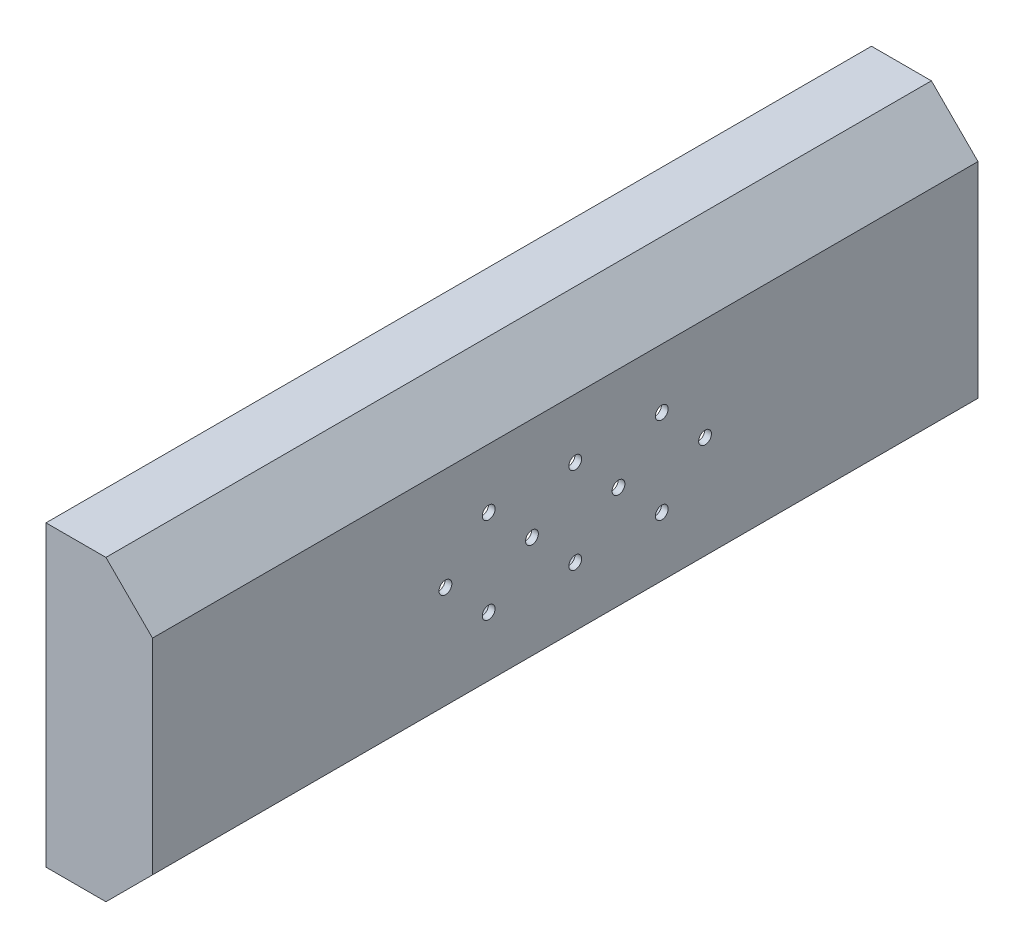
from build123d import *

# Parameters (mm, degrees)
SKETCH1_W                 = 20.32
SKETCH1_H                 = 157.48
BOSS_EXTRUDE1_DEPTH       = 56.896
CHAMFER1_SIZE             = 8.89
SHELL1_T                  = -1.27
F_2_CLEARANCE_HOLE1_D     = 2.4384
F_2_CLEARANCE_HOLE1_DEPTH = 7.62
F_2_CLEARANCE_HOLE1_TIP   = 0.732569267


with BuildPart() as part:
    # Sketch1 → Boss-Extrude1 (new body)
    with BuildSketch(Plane(origin=(0, 0, 0), x_dir=(1, 0, 0), z_dir=(0, 1, 0))):
        with Locations((10.16, 78.74)):
            Rectangle(SKETCH1_W, SKETCH1_H)
    extrude(amount=BOSS_EXTRUDE1_DEPTH)

    # Chamfer1
    chamfer1_edges = [part.edges().sort_by_distance(p)[0] for p in [
        (20.32, 56.896, -78.74),
        (20.32, 0, -78.74),
    ]]
    chamfer(chamfer1_edges, length=CHAMFER1_SIZE)

    # Shell1
    shell1_openings = [part.faces().sort_by_distance(p)[0] for p in [
        (0, 28.448, -78.74),
    ]]
    offset(amount=SHELL1_T, openings=shell1_openings, kind=Kind.INTERSECTION)

    # #2 Clearance Hole1
    with Locations(Plane(origin=(20.32, 0, 0), x_dir=(0, 0, -1), z_dir=(1, 0, 0))):
        with Locations((55.88, 28.448), (72.39, 28.448), (80.645, 36.703), (80.645, 20.193), (88.9, 28.448), (105.41, 28.448), (97.155, 36.703), (97.155, 20.193), (64.135, 36.703), (64.135, 20.193)):
            Hole(F_2_CLEARANCE_HOLE1_D / 2, depth=F_2_CLEARANCE_HOLE1_DEPTH)
            with Locations((0, 0, -(F_2_CLEARANCE_HOLE1_DEPTH + F_2_CLEARANCE_HOLE1_TIP / 2))):  # 118° drill point
                Cone(0, F_2_CLEARANCE_HOLE1_D / 2, F_2_CLEARANCE_HOLE1_TIP, mode=Mode.SUBTRACT)


solid = part.part
